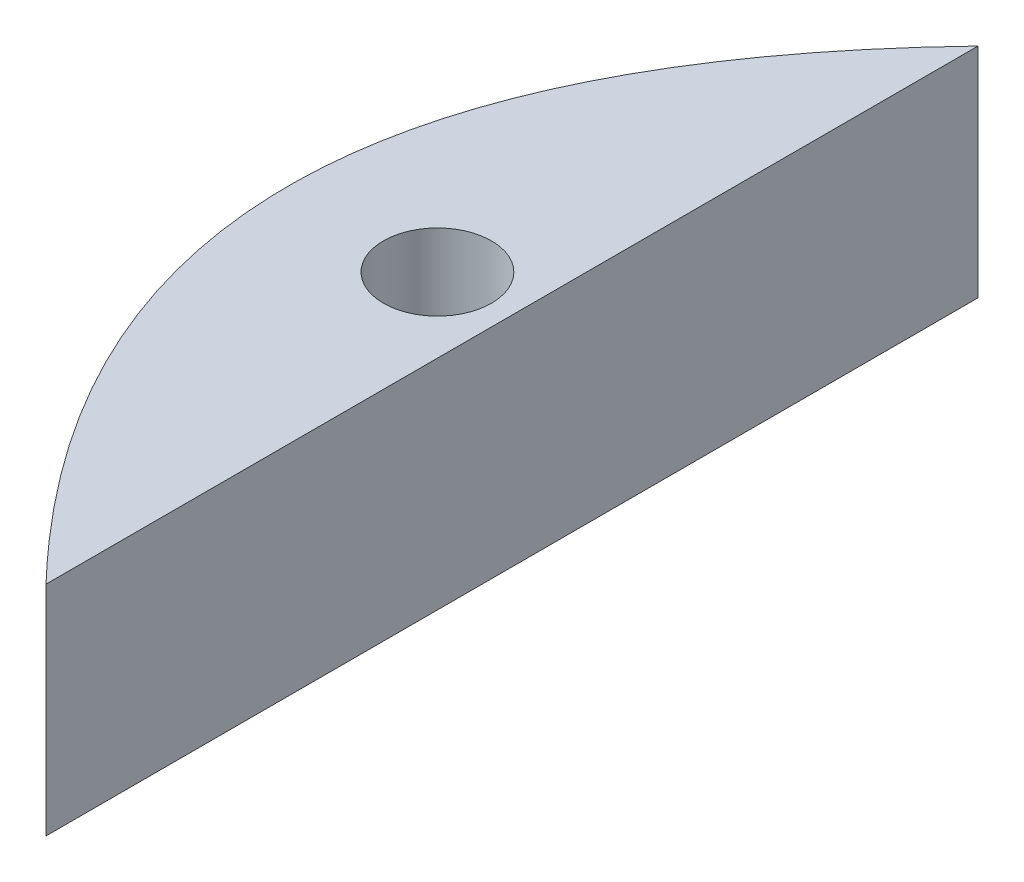
from build123d import *

# Parameters (mm, degrees)
SKETCH1_R           = 1.45
BOSS_EXTRUDE1_DEPTH = 5.85


with BuildPart() as part:
    # Sketch1 → Boss-Extrude1 (new body)
    with BuildSketch(Plane(origin=(0, 0, 0), x_dir=(1, 0, 0), z_dir=(0, 1, 0))):
        with BuildLine():
            Line((2, 12.5), (2, -12.5))
            add(Edge.make_bspline(
                [(2, 12.5), (-10, 0), (2, -12.5)],
                knots=[0, 0, 0, 1, 1, 1], degree=2))
        make_face()
        with Locations(Location((0, 0, 0), (0, 0, 270))):
            Circle(SKETCH1_R, mode=Mode.SUBTRACT)
    extrude(amount=BOSS_EXTRUDE1_DEPTH)


solid = part.part
